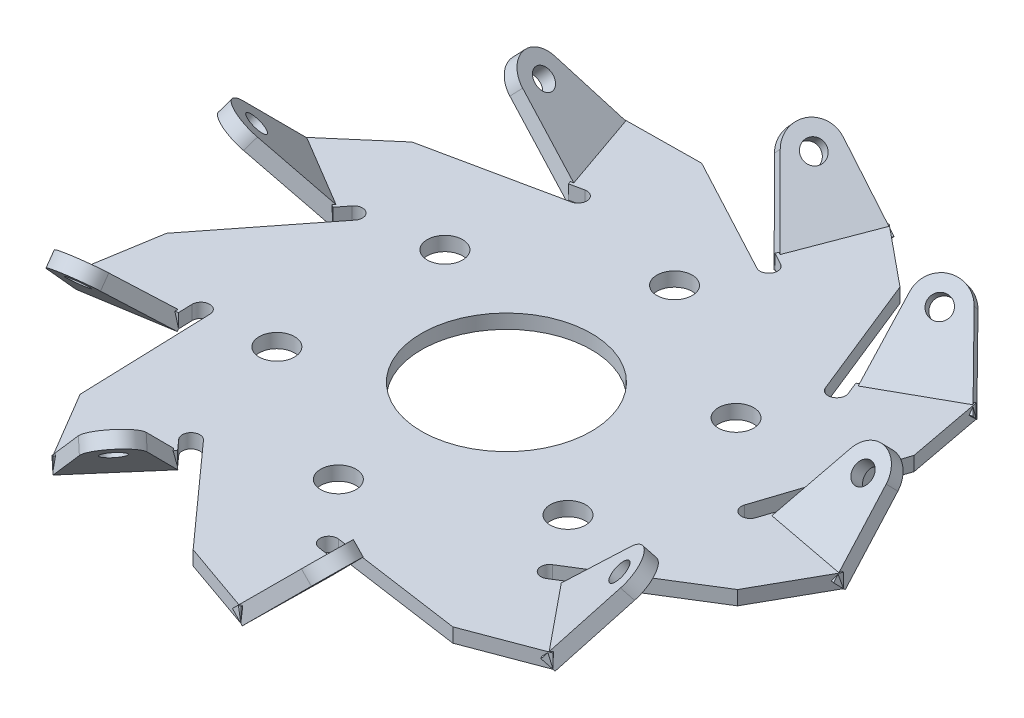
from build123d import *

# Parameters (mm, degrees)
BOSS_EXTRUDE1_DEPTH = 1
SKETCH8_R           = 2.5
CUT_EXTRUDE1_DEPTH  = 67.163866717
SKETCH9_R           = 12
CUT_EXTRUDE2_DEPTH  = 67.163866717
SKETCH11_R          = 1.5
BOSS_EXTRUDE2_DEPTH = 1
CIRPATTERN1_COUNT   = 9


with BuildPart() as part:
    # Sketch5 → Boss-Extrude1 (new, symmetric)
    with BuildSketch(Plane(origin=(0, 0, 0), x_dir=(1, 0, 0), z_dir=(0, 1, 0))):
        with BuildLine():
            Line((24.785164693, 24.591698316), (35.699009433, 30.685793244))
            Line((35.699009433, 30.685793244), (37.734335319, 19.87573087))
            Line((37.734335319, 19.87573087), (32.338236898, 3.376124396))
            Line((32.338236898, 3.376124396), (31.832819299, 1.830713092))
            ThreePointArc((31.832819299, 1.830713092), (32.625882824, 0.266821318), (34.189774598, 1.059884843))
            Line((34.189774598, 1.059884843), (34.793776664, 2.906737073))
            Line((34.793776664, 2.906737073), (47.071475492, 0.559800456))
            Line((47.071475492, 0.559800456), (41.682051423, -9.029470017))
            Line((41.682051423, -9.029470017), (26.942657607, -18.200356664))
            Line((26.942657607, -18.200356664), (25.562114025, -19.059334235))
            ThreePointArc((25.562114025, -19.059334235), (25.164385676, -20.767116246), (26.872167687, -21.164844595))
            Line((26.872167687, -21.164844595), (28.521993843, -20.138318751))
            Line((28.521993843, -20.138318751), (36.418675027, -29.828129187))
            Line((36.418675027, -29.828129187), (26.126272421, -33.709681532))
            Line((26.126272421, -33.709681532), (8.940309387, -31.260688567))
            Line((8.940309387, -31.260688567), (7.330611508, -31.031307253))
            ThreePointArc((7.330611508, -31.031307253), (5.9281928, -32.083889318), (6.980774865, -33.486308026))
            Line((6.980774865, -33.486308026), (8.904453117, -33.760431419))
            Line((8.904453117, -33.760431419), (8.725171768, -46.259145681))
            Line((8.725171768, -46.259145681), (-1.654279807, -42.616758416))
            Line((-1.654279807, -42.616758416), (-13.245308956, -29.693796865))
            Line((-13.245308956, -29.693796865), (-14.330965604, -28.483386733))
            ThreePointArc((-14.330965604, -28.483386733), (-16.081867372, -28.388254005), (-16.177000099, -30.139155773))
            Line((-16.177000099, -30.139155773), (-14.879580185, -31.585663021))
            Line((-14.879580185, -31.585663021), (-23.05093633, -41.044993798))
            Line((-23.05093633, -41.044993798), (-28.660776129, -31.582980405))
            Line((-28.660776129, -31.582980405), (-29.233300032, -14.232847601))
            Line((-29.233300032, -14.232847601), (-29.286924639, -12.607773003))
            ThreePointArc((-29.286924639, -12.607773003), (-30.56704307, -11.409439143), (-31.76537693, -12.689557574))
            Line((-31.76537693, -12.689557574), (-31.70129255, -14.631611859))
            Line((-31.70129255, -14.631611859), (-44.041255137, -16.625433152))
            Line((-44.041255137, -16.625433152), (-42.256576771, -5.771174857))
            Line((-42.256576771, -5.771174857), (-31.542705132, 7.887809237))
            Line((-31.542705132, 7.887809237), (-30.539206148, 9.167157835))
            ThreePointArc((-30.539206148, 9.167157835), (-30.749559601, 10.907979096), (-32.490380862, 10.697625642))
            Line((-32.490380862, 10.697625642), (-33.68961781, 9.168733104))
            Line((-33.68961781, 9.168733104), (-44.424181201, 15.573352437))
            Line((-44.424181201, 15.573352437), (-36.080055512, 22.741027546))
            Line((-36.080055512, 22.741027546), (-19.092927942, 26.317672469))
            Line((-19.092927942, 26.317672469), (-17.501853694, 26.65267364))
            ThreePointArc((-17.501853694, 26.65267364), (-16.544015452, 28.121432687), (-18.012774498, 29.07927093))
            Line((-18.012774498, 29.07927093), (-19.914196479, 28.678925948))
            Line((-19.914196479, 28.678925948), (-24.020539162, 40.485193342))
            Line((-24.020539162, 40.485193342), (-13.021275294, 40.612450423))
            Line((-13.021275294, 40.612450423), (2.290642426, 32.433204265))
            Line((2.290642426, 32.433204265), (3.724810614, 31.667107238))
            ThreePointArc((3.724810614, 31.667107238), (5.402657394, 32.176555389), (4.893209243, 33.854402169))
            Line((4.893209243, 33.854402169), (3.179298707, 34.769930611))
            Line((3.179298707, 34.769930611), (7.62258011, 46.453562339))
            Line((7.62258011, 46.453562339), (16.130304349, 39.480856389))
            Line((16.130304349, 39.480856389), (22.602395745, 23.37287933))
            Line((22.602395745, 23.37287933), (23.20859464, 21.864149418))
            ThreePointArc((23.20859464, 21.864149418), (24.821366801, 21.175910222), (25.509605997, 22.788682384))
            Line((25.509605997, 22.788682384), (24.785164693, 24.591698316))
        make_face()
    extrude(amount=BOSS_EXTRUDE1_DEPTH, both=True)

    # Sketch8 → Cut-Extrude1 (cut, through all)
    with BuildSketch(Plane(origin=(0, 1, 0), x_dir=(-1, 0, 0), z_dir=(0, 1, 0))):
        with Locations((0, 23.75)):
            Circle(SKETCH8_R)
        with Locations((-20.56810334, 11.875)):
            Circle(SKETCH8_R)
        with Locations((-20.56810334, -11.875)):
            Circle(SKETCH8_R)
        with Locations((20.56810334, 11.875)):
            Circle(SKETCH8_R)
        with Locations((20.56810334, -11.875)):
            Circle(SKETCH8_R)
        with Locations((0, -23.75)):
            Circle(SKETCH8_R)
    extrude(amount=-CUT_EXTRUDE1_DEPTH, mode=Mode.SUBTRACT)

    # Sketch9 → Cut-Extrude2 (cut, through all)
    with BuildSketch(Plane(origin=(0, 1, 0), x_dir=(-1, 0, 0), z_dir=(0, 1, 0))):
        Circle(SKETCH9_R)
    extrude(amount=-CUT_EXTRUDE2_DEPTH, mode=Mode.SUBTRACT)

    # Sketch11 → Boss-Extrude2 (add, symmetric)
    with BuildSketch(Plane(origin=(0.881297837, -4.693873234, -4.610396952), x_dir=(0.9911478412692893, 0.09471590489846116, 0.09303146836685591), z_dir=(-0.1327627837431396, 0.7071067811865471, 0.6945315279040779))):
        with BuildLine():
            Line((46.507996356, -0.301360521), (34.120642707, 1.372995945))
            Line((34.120642707, 1.372995945), (39.26748839, 12.181340653))
            ThreePointArc((39.26748839, 12.181340653), (43.1091624, 14.109547053), (45.922695903, 10.859859628))
            Line((45.922695903, 10.859859628), (46.507996356, -0.301360521))
        make_face()
        with Locations((42.427498518, 10.676569577)):
            Circle(SKETCH11_R, mode=Mode.SUBTRACT)
    boss_extrude2 = extrude(amount=BOSS_EXTRUDE2_DEPTH, both=True)

    # CirPattern1: Boss-Extrude2 ×9 about axis
    cirpattern1_axis = Axis((0, 0, 0), (0, 1, 0))
    for i in range(1, CIRPATTERN1_COUNT):
        add(boss_extrude2.rotate(cirpattern1_axis, i * 360 / CIRPATTERN1_COUNT))


solid = part.part
